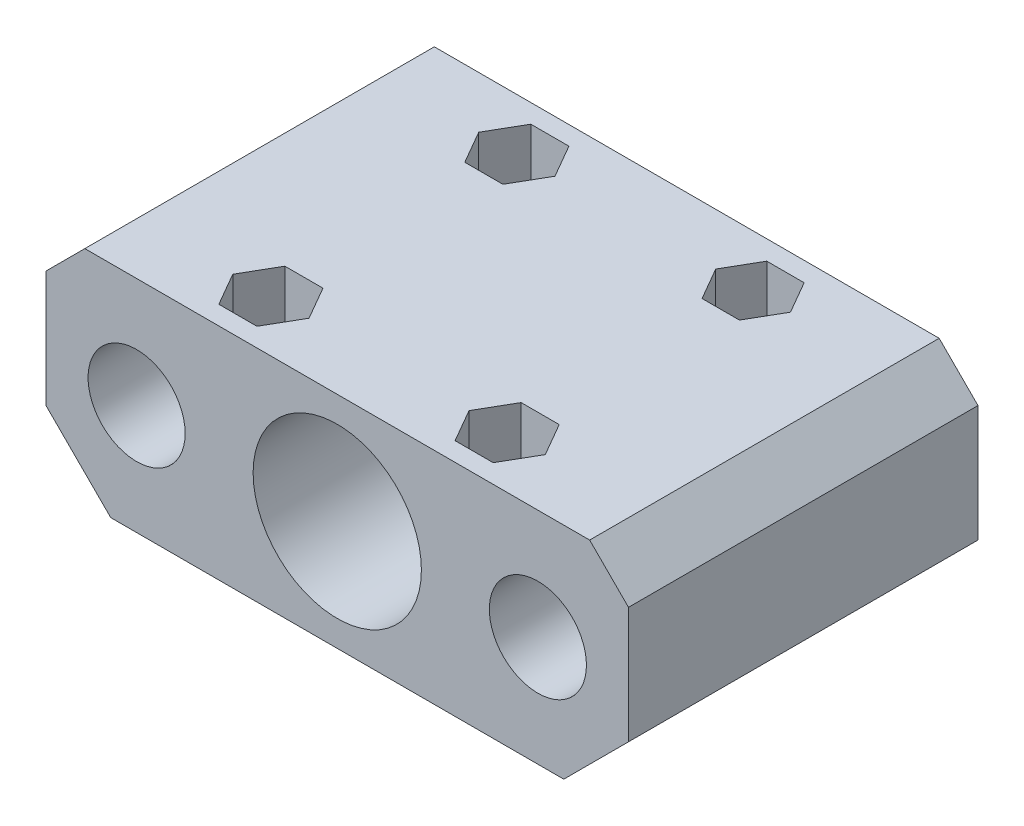
from build123d import *

# Parameters (mm, degrees)
SKETCH1_W           = 90
SKETCH1_H           = 34
SKETCH1_R           = 7
SKETCH1_R_2         = 7.5
BOSS_EXTRUDE1_DEPTH = 54
CHAMFER1_SIZE       = 6
CHAMFER2_SIZE       = 10
SKETCH2_R           = 13
CUT_EXTRUDE1_DEPTH  = 32
SKETCH3_R           = 3.1
CUT_EXTRUDE2_DEPTH  = 111.326787318
CUT_EXTRUDE3_DEPTH  = 10
SKETCH5_R           = 1.5
CUT_EXTRUDE4_DEPTH  = 102.390334845
CIRPATTERN1_COUNT   = 4
CHAMFER3_SIZE       = 0.5


with BuildPart() as part:
    # Sketch1 → Boss-Extrude1 (new body)
    with BuildSketch(Plane.XY):
        with Locations((45, 17)):
            Rectangle(SKETCH1_W, SKETCH1_H)
        with Locations((45, 17)):
            Circle(SKETCH1_R, mode=Mode.SUBTRACT)
        with Locations((14, 17)):
            Circle(SKETCH1_R_2, mode=Mode.SUBTRACT)
        with Locations((76, 17)):
            Circle(SKETCH1_R_2, mode=Mode.SUBTRACT)
    extrude(amount=BOSS_EXTRUDE1_DEPTH)

    # Chamfer1
    chamfer1_edges = [part.edges().sort_by_distance(p)[0] for p in [
        (0, 34, 27),
        (90, 34, 27),
    ]]
    chamfer(chamfer1_edges, length=CHAMFER1_SIZE)

    # Chamfer2
    chamfer2_edges = [part.edges().sort_by_distance(p)[0] for p in [
        (90, 0, 27),
        (0, 0, 27),
    ]]
    chamfer(chamfer2_edges, length=CHAMFER2_SIZE)

    # Sketch2 → Cut-Extrude1 (cut)
    with BuildSketch(Plane.XY.offset(54)):
        with Locations((45, 17)):
            Circle(SKETCH2_R)
    extrude(amount=-CUT_EXTRUDE1_DEPTH, mode=Mode.SUBTRACT)

    # Sketch3 → Cut-Extrude2 (cut, through all)
    with BuildSketch(Plane(origin=(0, 34, 0), x_dir=(1, 0, 0), z_dir=(0, 1, 0))):
        with Locations(Location((26.75, -8, 0), (0, 0, 270))):
            Circle(SKETCH3_R)
        with Locations(Location((63.25, -8, 0), (0, 0, 270))):
            Circle(SKETCH3_R)
        with Locations(Location((63.25, -46, 0), (0, 0, 270))):
            Circle(SKETCH3_R)
        with Locations(Location((26.75, -46, 0), (0, 0, 270))):
            Circle(SKETCH3_R)
    extrude(amount=-CUT_EXTRUDE2_DEPTH, mode=Mode.SUBTRACT)

    # Sketch4 → Cut-Extrude3 (cut)
    with BuildSketch(Plane(origin=(0, 34, 0), x_dir=(1, 0, 0), z_dir=(0, 1, 0))):
        Polygon((23.805513627, -13.1), (29.694486373, -13.1), (32.638972746, -8), (29.694486373, -2.9), (23.805513627, -2.9), (20.861027254, -8), align=None)
        Polygon((60.363248654, -13), (66.136751346, -13), (69.023502692, -8), (66.136751346, -3), (60.363248654, -3), (57.476497308, -8), align=None)
        Polygon((60.305513627, -51.1), (66.194486373, -51.1), (69.138972746, -46), (66.194486373, -40.9), (60.305513627, -40.9), (57.361027254, -46), align=None)
        Polygon((29.694486373, -51.1), (32.638972746, -46), (29.694486373, -40.9), (23.805513627, -40.9), (20.861027254, -46), (23.805513627, -51.1), align=None)
    extrude(amount=-CUT_EXTRUDE3_DEPTH, mode=Mode.SUBTRACT)

    # Sketch5 → Cut-Extrude4 (cut, through all)
    with BuildSketch(Plane.XY.offset(22)):
        with Locations((45, 25)):
            Circle(SKETCH5_R)
    cut_extrude4 = extrude(amount=-CUT_EXTRUDE4_DEPTH, mode=Mode.SUBTRACT)

    # CirPattern1: Cut-Extrude4 ×4 about axis
    cirpattern1_axis = Axis((45, 17, 0), (0, 0, 1))
    for i in range(1, CIRPATTERN1_COUNT):
        add(cut_extrude4.rotate(cirpattern1_axis, i * 360 / CIRPATTERN1_COUNT), mode=Mode.SUBTRACT)

    # Chamfer3
    chamfer3_edges = [part.edges().sort_by_distance(p)[0] for p in [
        (26.75, 0, 42.9),
        (63.25, 0, 42.9),
        (63.25, 0, 4.9),
        (26.75, 0, 4.9),
    ]]
    chamfer(chamfer3_edges, length=CHAMFER3_SIZE)


solid = part.part
